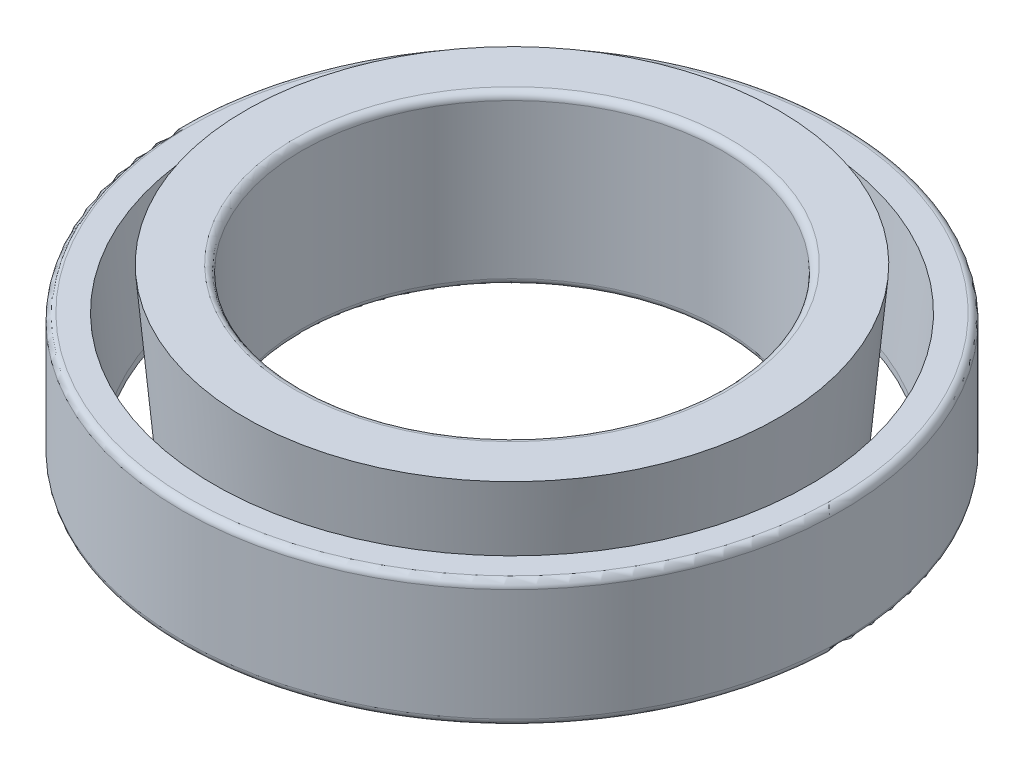
from build123d import *

# Parameters (mm, degrees)
VERRUNDUNG1_R = 0.5
VERRUNDUNG2_R = 0.5


with BuildPart() as part:
    # Skizze1 → Rotation1 (revolve)
    with BuildSketch(Plane.XY, mode=Mode.PRIVATE) as rotation1_sk:
        Polygon((15, -0.013170206), (15, 11.986829794), (19, 11.986829794), (17.94647296, -0.013170206), align=None)
        Polygon((21.255424897, 9), (23.5, 9), (23.5, 0), (20.583672238, 0), (20.583672238, 0.486829794), align=None)
    revolve(rotation1_sk.sketch.rotate(Axis((0, 0, 0), (0, 1, 0)), 90), axis=Axis((0, 0, 0), (0, 1, 0)))

    # Verrundung1
    verrundung1_edges = [part.edges().sort_by_distance(p)[0] for p in [
        (0, 11.986829794, 15),
        (0, -0.013170206, 15),
    ]]
    fillet(verrundung1_edges, radius=VERRUNDUNG1_R)

    # Verrundung2
    verrundung2_edges = [part.edges().sort_by_distance(p)[0] for p in [
        (0, 0, 23.5),
        (0, 9, 23.5),
    ]]
    fillet(verrundung2_edges, radius=VERRUNDUNG2_R)


solid = part.part
